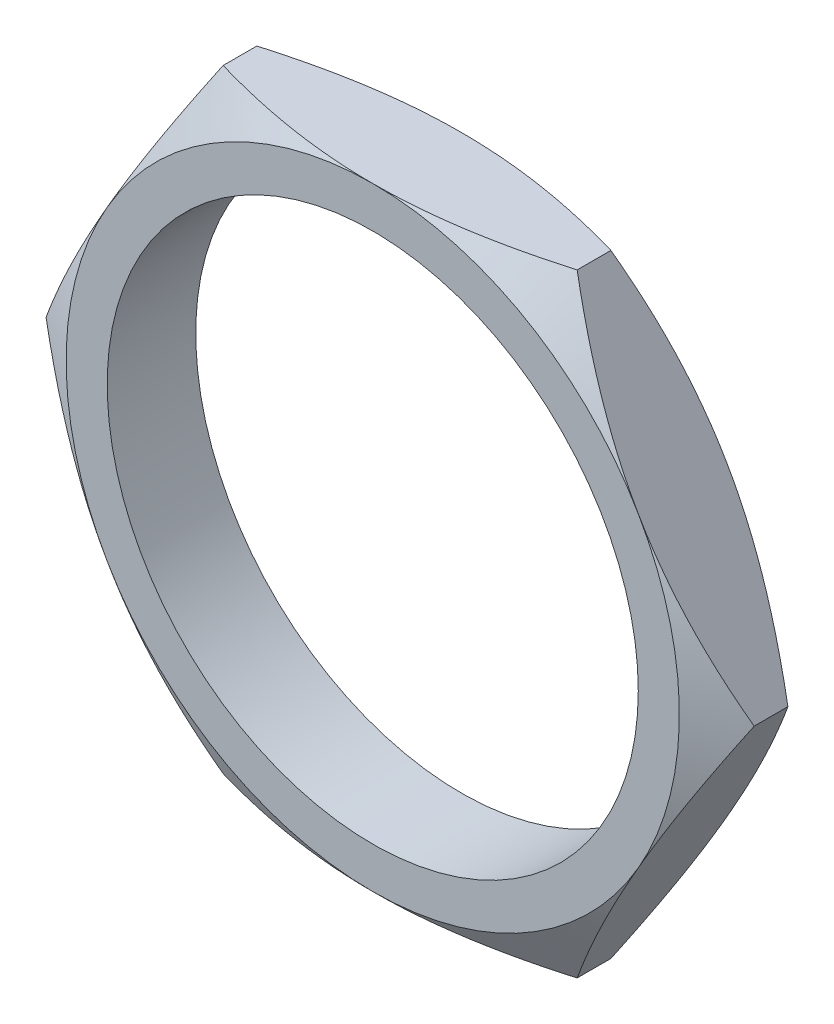
from build123d import *

# Parameters (mm, degrees)
DODANIE_WYCI_GNI_CIE1_DEPTH = 5
SZKIC2_OUTSIDE_W            = 139.232
SZKIC2_OUTSIDE_H            = 133.874
SZKIC2_OUTSIDE_R            = 17.320508076
WYTNIJ_WYCI_GNI_CIE1_DEPTH  = 25
WYTNIJ_WYCI_GNI_CIE1_DRAFT  = 60
SZKIC3_R                    = 15
WYTNIJ_WYCI_GNI_CIE5_DEPTH  = 15
SZKIC5_OUTSIDE_W            = 87.272
SZKIC5_OUTSIDE_H            = 81.914
SZKIC5_OUTSIDE_R            = 17.320508076
WYTNIJ_WYCI_GNI_CIE8_DEPTH  = 10
WYTNIJ_WYCI_GNI_CIE8_TAPER  = 60


with BuildPart() as part:
    # Szkic1 → Dodanie-wyciągnięcie1 (new body)
    with BuildSketch(Plane.XY):
        Polygon((10, 17.320508076), (-10, 17.320508076), (-20, 0), (-10, -17.320508076), (10, -17.320508076), (20, 0), align=None)
    extrude(amount=DODANIE_WYCI_GNI_CIE1_DEPTH)


with BuildPart() as wytnij_wyci_gni_cie1_tool:
    # Szkic2 outside → Wytnij-wyciągnięcie1 (with draft: the straight prism first)
    with BuildSketch(Plane.XY):
        Rectangle(SZKIC2_OUTSIDE_W, SZKIC2_OUTSIDE_H)
        Circle(SZKIC2_OUTSIDE_R, mode=Mode.SUBTRACT)
    extrude(amount=WYTNIJ_WYCI_GNI_CIE1_DEPTH)
    # Wytnij-wyciągnięcie1: the draft: its side faces are tilted about the plane it starts from
    wytnij_wyci_gni_cie1_sides = [wytnij_wyci_gni_cie1_tool.faces().sort_by_distance(p)[0] for p in [
        (0, -66.937, 12.5),
        (69.616, 0, 12.5),
        (0, 66.937, 12.5),
        (-69.616, 0, 12.5),
        (-17.320508076, 0, 12.5),
    ]]
    draft(wytnij_wyci_gni_cie1_sides, Plane.XY, WYTNIJ_WYCI_GNI_CIE1_DRAFT)


with BuildPart() as part_1:
    add(part.part)

    # Wytnij-wyciągnięcie1: cut by wytnij_wyci_gni_cie1_tool
    add(wytnij_wyci_gni_cie1_tool.part, mode=Mode.SUBTRACT)

    # Szkic3 → Wytnij-wyciągnięcie5 (cut)
    with BuildSketch(Plane.XY):
        Circle(SZKIC3_R)
    extrude(amount=WYTNIJ_WYCI_GNI_CIE5_DEPTH, mode=Mode.SUBTRACT)

    # Szkic5 outside → Wytnij-wyciągnięcie8 (cut)
    with BuildSketch(Plane.XY.offset(5)):
        Rectangle(SZKIC5_OUTSIDE_W, SZKIC5_OUTSIDE_H)
        Circle(SZKIC5_OUTSIDE_R, mode=Mode.SUBTRACT)
    extrude(amount=-WYTNIJ_WYCI_GNI_CIE8_DEPTH, taper=WYTNIJ_WYCI_GNI_CIE8_TAPER, mode=Mode.SUBTRACT)


solid = part_1.part
